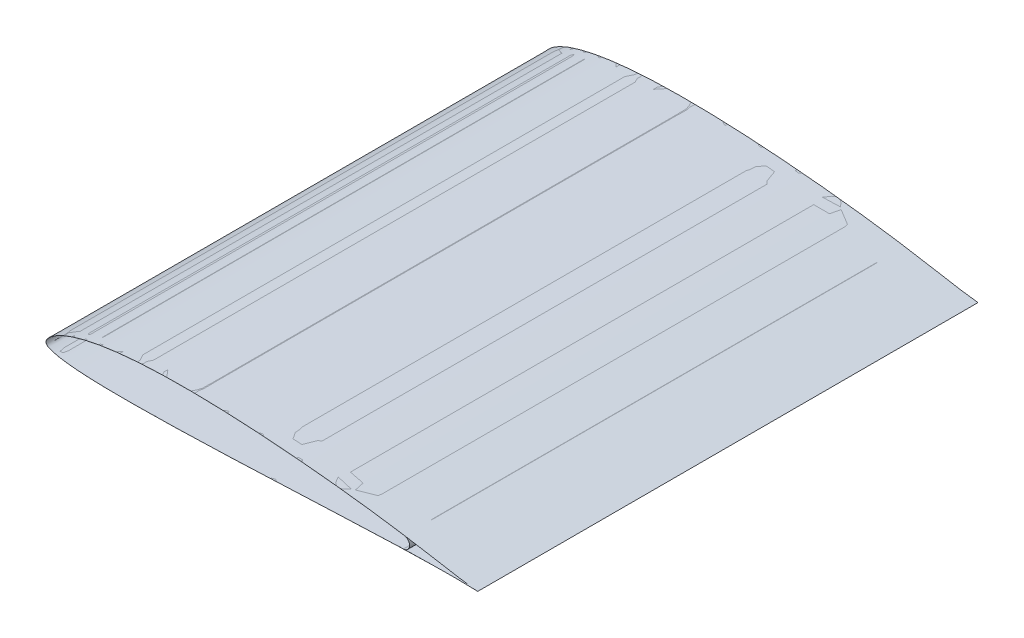
from build123d import *

# Parameters (mm, degrees)
BOSS_EXTRUDE2_DEPTH = 177.8


with BuildPart() as part:
    # Sketch1 → Boss-Extrude2 (new body)
    # profile 1 of 2: a face of its own
    with BuildSketch(Plane.XY):
        with BuildLine():
            add(Edge.make_bspline(
                [(153.379057906, -0.076420881), (151.77740365, 0.100854529), (148.580541305, 0.515918064), (142.224453046, 1.602514534), (134.28964085, 3.017786397), (124.745166456, 4.592559207), (111.973486471, 6.39462663), (99.15606173, 7.840693804), (86.311777833, 9.009519717), (76.665367852, 9.729317951), (67.007341033, 10.27431232), (57.339704618, 10.617718173), (47.665971864, 10.715915102), (39.605107967, 10.542389173), (33.164323293, 10.199730004), (28.341831633, 9.816599176), (23.532608356, 9.286974633), (18.746768528, 8.572714796), (14.791332902, 7.779456199), (11.664340776, 6.983704673), (9.346267871, 6.288733424), (7.063670915, 5.471886847), (5.217090441, 4.66052239), (3.79163352, 3.904034706), (2.746513469, 3.273618433), (1.758438858, 2.560612955), (1.034871868, 1.880223233), (0.510493424, 1.252204706), (0.128360777, 0.727277365), (-0.088148143, 0.143121397), (0.069134123, -0.49611806), (0.475877127, -0.995188705), (1.016211242, -1.291282345), (1.609535678, -1.501164041), (2.38122443, -1.763396464), (3.337970171, -2.049315145), (4.513351228, -2.314607602), (5.711245114, -2.518541643), (7.314509514, -2.744044872), (9.314947259, -2.971898551), (11.724514171, -3.171150085), (14.140443115, -3.315512216), (17.362254429, -3.458557354), (21.391259806, -3.562652918), (26.228077196, -3.609195376), (31.064451592, -3.602505762), (37.512729928, -3.541003642), (45.571817387, -3.382693816), (55.240423574, -3.10688169), (64.907106306, -2.77299371), (77.793769659, -2.268687978), (93.898719119, -1.559529393), (113.223428672, -0.688177568), (129.333517621, -0.104429619), (142.227418779, 0.124949386), (148.676084166, 0.104077615), (151.897491474, -0.008870502)],
                knots=[-0.003181256, -0.003181256, -0.003181256, -0.003181256, 0.012493452, 0.028168159, 0.059517573, 0.090866987, 0.122216401, 0.18491523, 0.216264644, 0.247614058, 0.278963473, 0.310312887, 0.341662301, 0.373011715, 0.388686422, 0.404361129, 0.420035837, 0.435710544, 0.451385251, 0.459222604, 0.467059958, 0.474897312, 0.482734665, 0.486653342, 0.490572019, 0.494490695, 0.498409372, 0.500368711, 0.502328049, 0.504287387, 0.506246726, 0.508206064, 0.510165403, 0.512124741, 0.514084079, 0.518002756, 0.521921433, 0.52584011, 0.529758786, 0.53759614, 0.545433494, 0.553270847, 0.561108201, 0.576782908, 0.592457615, 0.608132322, 0.623807029, 0.655156443, 0.686505858, 0.717855272, 0.749204686, 0.811903515, 0.874602343, 0.937301172, 0.968650586, 1, 1, 1, 1], degree=3))
            Line((151.897491474, -0.008870502), (153.379057906, -0.076420881))
        make_face()
        with BuildLine():
            Line((152.4, 0), (151.898604, 0.02286))
            add(Edge.make_bspline(
                [(127.131811048, -0.182515786), (127.969049918, -0.157067988), (130.712072988, -0.077352381), (135.123521438, 0.027974451), (140.103603919, 0.108900525), (144.29941542, 0.13993859), (147.644768246, 0.124243061), (150.083437285, 0.086502888), (151.399782071, 0.04034956), (151.898604, 0.02286)],
                knots=[0.919711593, 0.919711593, 0.919711593, 0.919711593, 0.92785625, 0.946394646, 0.962618154, 0.976286171, 0.987192828, 0.99514679, 1, 1, 1, 1], degree=3))
            ThreePointArc((127.131811048, -0.182515786), (127.0659361, -0.185527238), (127, -0.186531366))
            add(Edge.make_bspline(
                [(127.3401151, 4.11729157), (126.635520471, 4.229354399), (123.858504945, 4.664582982), (118.864690135, 5.397753278), (112.233312125, 6.272974236), (105.243489487, 7.106058892), (97.969665406, 7.889319693), (90.492724993, 8.606734858), (82.895253241, 9.240670251), (75.258667902, 9.77749908), (67.662928423, 10.198815718), (60.186827499, 10.49170102), (52.905945954, 10.645080099), (45.891743713, 10.644551806), (39.210681048, 10.486247597), (32.923263797, 10.164412711), (27.083700854, 9.670939726), (21.73719754, 9.016508091), (16.924344759, 8.204081974), (12.676275305, 7.249770479), (9.019815693, 6.174457771), (5.965694819, 5.002018522), (3.544032537, 3.769871526), (1.704834708, 2.531499726), (0.575239506, 1.344737529), (-0.170728015, 0.20310696), (0.337603285, -1.001772228), (1.792943226, -1.546726795), (3.794232235, -2.17716446), (6.643400201, -2.643922316), (10.216110654, -3.041953632), (14.530084187, -3.319872228), (19.533969629, -3.497677255), (25.18692206, -3.577638345), (31.428627275, -3.573848082), (38.191948203, -3.496581442), (45.401595317, -3.349308986), (52.97841726, -3.141841288), (60.83867414, -2.885262261), (68.894988424, -2.587930905), (77.057432025, -2.258882887), (85.235009672, -1.907730283), (93.335426834, -1.550168819), (101.266049649, -1.195465221), (108.93417081, -0.862411006), (116.2464986, -0.557504045), (122.229152262, -0.339098352), (125.763798377, -0.224277802), (127, -0.186531366)],
                knots=[0.08232001, 0.08232001, 0.08232001, 0.08232001, 0.089257218, 0.109651763, 0.131396199, 0.15429467, 0.178096903, 0.202530723, 0.227328973, 0.252225807, 0.276966075, 0.301296827, 0.324972089, 0.347773046, 0.369493849, 0.389946985, 0.408979416, 0.42646579, 0.442306729, 0.45642124, 0.468773538, 0.47934515, 0.488155641, 0.495223141, 0.500608248, 0.504417036, 0.507344225, 0.511892731, 0.518766333, 0.5280624, 0.539750485, 0.553781924, 0.570059197, 0.588441486, 0.608747967, 0.630750044, 0.65420771, 0.678865071, 0.70445057, 0.730677503, 0.757253937, 0.783882587, 0.810265561, 0.836095192, 0.861073222, 0.884896986, 0.907258357, 0.919284173, 0.919284173, 0.919284173, 0.919284173], degree=3))
            add(Edge.make_bspline(
                [(152.4, 0), (152.232833718, 0.018502415), (151.571843934, 0.091662545), (150.113999557, 0.2838596), (147.749385864, 0.638650629), (144.555943786, 1.170157002), (140.615360499, 1.859099247), (136.007834995, 2.67146013), (131.509589167, 3.442331365), (128.553180162, 3.924358645), (127.3401151, 4.11729157)],
                knots=[0, 0, 0, 0, 0.001635356, 0.006466337, 0.014296592, 0.024884209, 0.037943993, 0.053194137, 0.070376569, 0.08232001, 0.08232001, 0.08232001, 0.08232001], degree=3))
        make_face(mode=Mode.SUBTRACT)
    # profile 2 of 2: a face of its own
    with BuildSketch(Plane.XY):
        with BuildLine():
            add(Edge.make_bspline(
                [(127.131811048, -0.182515786), (127.969049918, -0.157067988), (130.712072988, -0.077352381), (135.123521438, 0.027974451), (140.103603919, 0.108900525), (144.29941542, 0.13993859), (147.644768246, 0.124243061), (150.083437285, 0.086502888), (151.399782071, 0.04034956), (151.898604, 0.02286)],
                knots=[0.919711593, 0.919711593, 0.919711593, 0.919711593, 0.92785625, 0.946394646, 0.962618154, 0.976286171, 0.987192828, 0.99514679, 1, 1, 1, 1], degree=3))
            Line((151.898604, 0.02286), (152.4, 0))
            add(Edge.make_bspline(
                [(152.4, 0), (152.232833718, 0.018502415), (151.571843934, 0.091662545), (150.113999557, 0.2838596), (147.749385864, 0.638650629), (144.555943786, 1.170157002), (140.615360499, 1.859099247), (136.007834995, 2.67146013), (131.509589167, 3.442331365), (128.553180162, 3.924358645), (127.3401151, 4.11729157)],
                knots=[0, 0, 0, 0, 0.001635356, 0.006466337, 0.014296592, 0.024884209, 0.037943993, 0.053194137, 0.070376569, 0.08232001, 0.08232001, 0.08232001, 0.08232001], degree=3))
            ThreePointArc((127.3401151, 4.11729157), (129.162814, 1.874041651), (127.131811048, -0.182515786))
        make_face()
    extrude(amount=BOSS_EXTRUDE2_DEPTH)


solid = part.part
